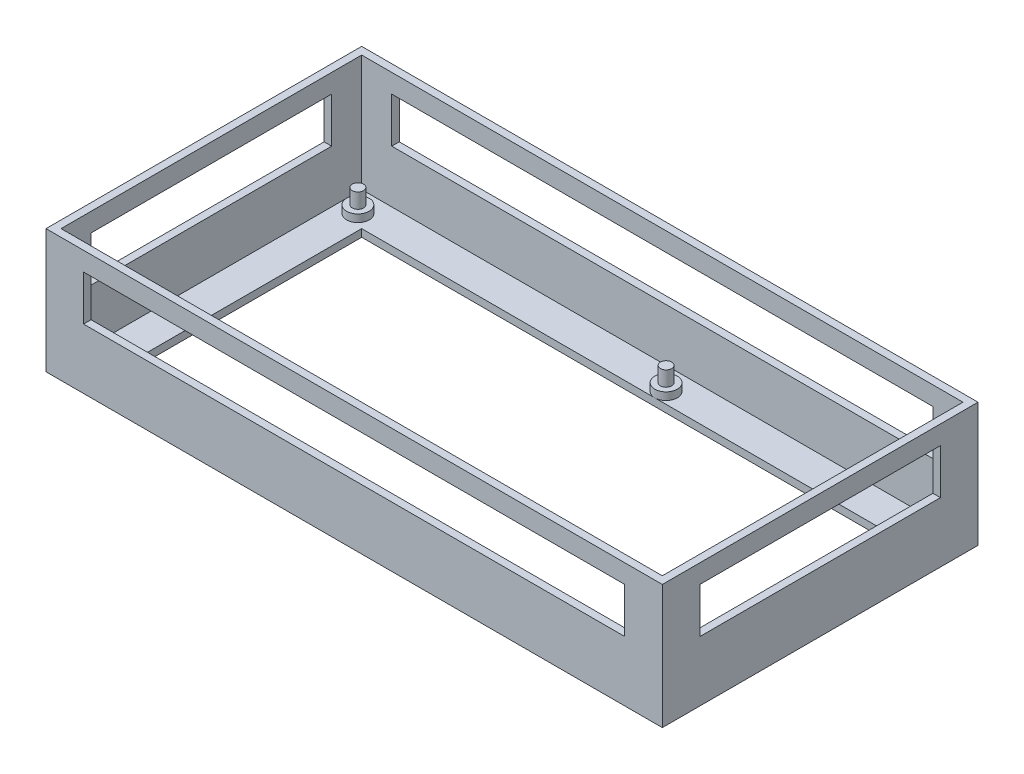
from build123d import *

# Parameters (mm, degrees)
SKETCH1_W           = 164
SKETCH1_H           = 84
BOSS_EXTRUDE1_DEPTH = 33
SHELL1_T            = -2
SKETCH3_W           = 142
SKETCH3_H           = 62
CUT_EXTRUDE1_DEPTH  = 2
SKETCH4_R           = 3
BOSS_EXTRUDE2_DEPTH = 2
SKETCH5_R           = 1.5
BOSS_EXTRUDE3_DEPTH = 4
SKETCH6_R           = 3
BOSS_EXTRUDE4_DEPTH = 2
SKETCH7_R           = 1.5
BOSS_EXTRUDE5_DEPTH = 4
SKETCH8_W           = 64
SKETCH8_H           = 12
CUT_EXTRUDE2_DEPTH  = 188.192414376
SKETCH9_W           = 144
SKETCH9_H           = 12
CUT_EXTRUDE3_DEPTH  = 188.192414376


with BuildPart() as part:
    # Sketch1 → Boss-Extrude1 (new body)
    with BuildSketch(Plane(origin=(0, 0, 0), x_dir=(1, 0, 0), z_dir=(0, 1, 0))):
        with Locations((82, 42)):
            Rectangle(SKETCH1_W, SKETCH1_H)
    extrude(amount=BOSS_EXTRUDE1_DEPTH)

    # Shell1
    shell1_openings = [part.faces().sort_by_distance(p)[0] for p in [
        (82, 33, -42),
    ]]
    offset(amount=SHELL1_T, openings=shell1_openings, kind=Kind.INTERSECTION)

    # Sketch3 → Cut-Extrude1 (cut)
    with BuildSketch(Plane(origin=(0, 2, 0), x_dir=(1, 0, 0), z_dir=(0, 1, 0))):
        with Locations((82, 42)):
            Rectangle(SKETCH3_W, SKETCH3_H)
    extrude(amount=-CUT_EXTRUDE1_DEPTH, mode=Mode.SUBTRACT)

    # Sketch4 → Boss-Extrude2 (add)
    with BuildSketch(Plane(origin=(0, 2, 0), x_dir=(1, 0, 0), z_dir=(0, 1, 0))):
        with Locations(Location((157, 76, 0), (0, 0, 90))):
            Circle(SKETCH4_R)
        with Locations(Location((89, 76, 0), (0, 0, 270))):
            Circle(SKETCH4_R)
        with Locations(Location((89, 8, 0), (0, 0, 90))):
            Circle(SKETCH4_R)
        with Locations(Location((157, 8, 0), (0, 0, 90))):
            Circle(SKETCH4_R)
    extrude(amount=BOSS_EXTRUDE2_DEPTH)

    # Sketch5 → Boss-Extrude3 (add)
    with BuildSketch(Plane(origin=(0, 4, 0), x_dir=(1, 0, 0), z_dir=(0, 1, 0))):
        with Locations(Location((89, 76, 0), (0, 0, 270))):
            Circle(SKETCH5_R)
        with Locations(Location((157, 76, 0), (0, 0, 270))):
            Circle(SKETCH5_R)
        with Locations(Location((89, 8, 0), (0, 0, 270))):
            Circle(SKETCH5_R)
        with Locations(Location((157, 8, 0), (0, 0, 270))):
            Circle(SKETCH5_R)
    extrude(amount=BOSS_EXTRUDE3_DEPTH)

    # Sketch6 → Boss-Extrude4 (add)
    with BuildSketch(Plane(origin=(0, 2, 0), x_dir=(1, 0, 0), z_dir=(0, 1, 0))):
        with Locations(Location((7, 76, 0), (0, 0, 90))):
            Circle(SKETCH6_R)
        with Locations(Location((7, 8, 0), (0, 0, 90))):
            Circle(SKETCH6_R)
        with Locations(Location((63, 8, 0), (0, 0, 90))):
            Circle(SKETCH6_R)
    extrude(amount=BOSS_EXTRUDE4_DEPTH)

    # Sketch7 → Boss-Extrude5 (add)
    with BuildSketch(Plane(origin=(0, 4, 0), x_dir=(1, 0, 0), z_dir=(0, 1, 0))):
        with Locations(Location((7, 76, 0), (0, 0, 270))):
            Circle(SKETCH7_R)
        with Locations(Location((7, 8, 0), (0, 0, 270))):
            Circle(SKETCH7_R)
        with Locations(Location((63, 8, 0), (0, 0, 270))):
            Circle(SKETCH7_R)
    extrude(amount=BOSS_EXTRUDE5_DEPTH)

    # Sketch8 → Cut-Extrude2 (cut, through all)
    with BuildSketch(Plane.ZY):
        with Locations((-42, 22)):
            Rectangle(SKETCH8_W, SKETCH8_H)
    extrude(amount=-CUT_EXTRUDE2_DEPTH, mode=Mode.SUBTRACT)

    # Sketch9 → Cut-Extrude3 (cut, through all)
    with BuildSketch(Plane.XY):
        with Locations((82, 22)):
            Rectangle(SKETCH9_W, SKETCH9_H)
    extrude(amount=-CUT_EXTRUDE3_DEPTH, mode=Mode.SUBTRACT)


solid = part.part
